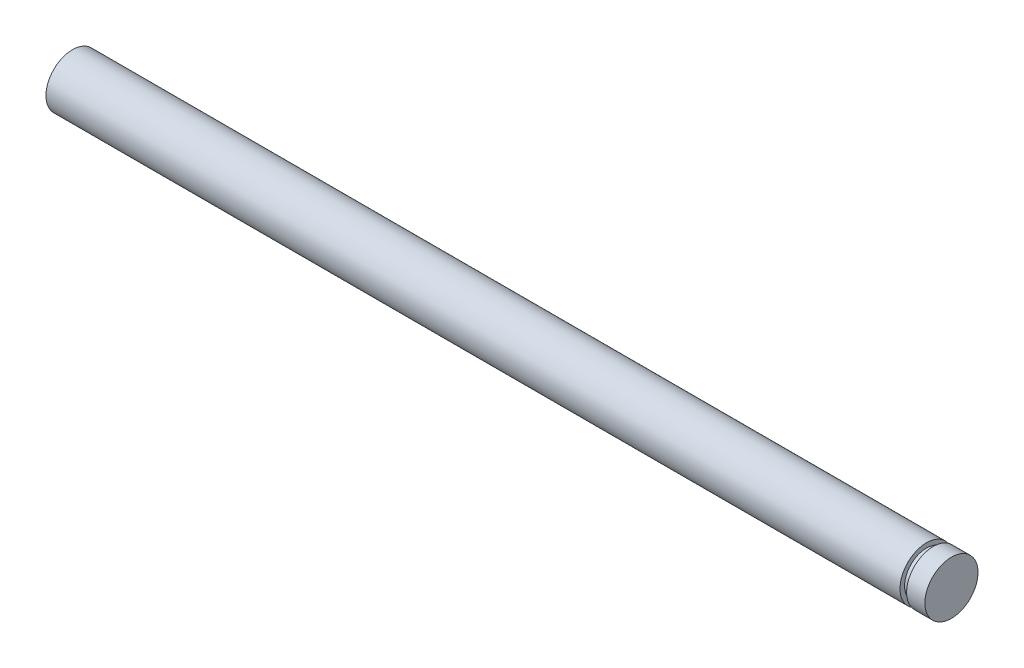
from build123d import *


with BuildPart() as part:
    # Sketch1 → Revolve1 (revolve)
    with BuildSketch(Plane.XY, mode=Mode.PRIVATE) as revolve1_sk:
        Polygon((0, 0), (0, 0.725), (23.32, 0.725), (23.32, 0.6), (23.5, 0.6), (23.5, 0.725), (24, 0.725), (24, 0), align=None)
    revolve(revolve1_sk.sketch.rotate(Axis((24, 0, 0), (-1, 0, 0)), 90), axis=Axis((24, 0, 0), (-1, 0, 0)))


solid = part.part
